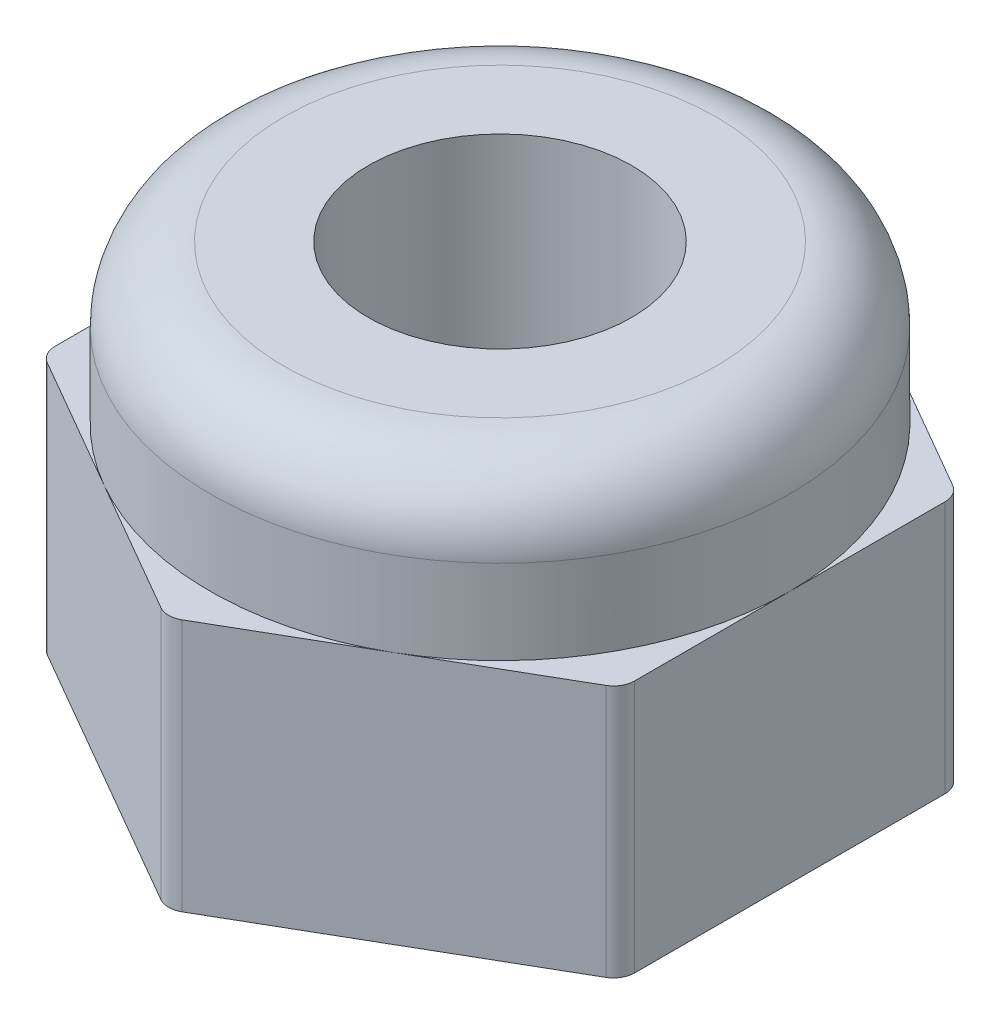
from build123d import *

# Parameters (mm, degrees)
EXTRUDE_1_DEPTH        = 2.4
SKETCH_2_R             = 2.75
EXTRUDE_2_DEPTH        = 3.9
FILLET_1_R             = 0.7
FILLET_2_R             = 0.2
HOLE_WIZARD_M3_1_D     = 2.5
HOLE_WIZARD_M3_1_DEPTH = 7.5
HOLE_WIZARD_M3_1_TIP   = 0.751075774


with BuildPart() as part:
    # 草图1 → 凸台-拉伸1 (new body)
    with BuildSketch(Plane(origin=(0, 0, 0), x_dir=(1, 0, 0), z_dir=(0, 1, 0))):
        Polygon((0, 3.175426481), (-2.75, 1.58771324), (-2.75, -1.58771324), (0, -3.175426481), (2.75, -1.58771324), (2.75, 1.58771324), align=None)
    extrude(amount=EXTRUDE_1_DEPTH)

    # 草图2 → 凸台-拉伸2 (add)
    with BuildSketch(Plane.XZ):
        with Locations(Location((0, 0, 0), (0, 0, 270))):
            Circle(SKETCH_2_R)
    extrude(amount=-EXTRUDE_2_DEPTH)

    # 圆角1
    fillet_1_edges = [part.edges().sort_by_distance(p)[0] for p in [
        (0, 3.9, 2.75),
    ]]
    fillet(fillet_1_edges, radius=FILLET_1_R)

    # 圆角2
    fillet_2_edges = [part.edges().sort_by_distance(p)[0] for p in [
        (2.75, 1.2, -1.58771324),
        (2.75, 1.2, 1.58771324),
        (0, 1.2, 3.175426481),
        (-2.75, 1.2, 1.58771324),
        (-2.75, 1.2, -1.58771324),
        (0, 1.2, -3.175426481),
    ]]
    fillet(fillet_2_edges, radius=FILLET_2_R)

    # M3 螺纹孔1
    with Locations(Plane(origin=(0, 0, 0), x_dir=(-1, 0, 0), z_dir=(0, -1, 0))):
        with Locations((0, 0)):
            Hole(HOLE_WIZARD_M3_1_D / 2, depth=HOLE_WIZARD_M3_1_DEPTH)
            with Locations((0, 0, -(HOLE_WIZARD_M3_1_DEPTH + HOLE_WIZARD_M3_1_TIP / 2))):  # 118° drill point
                Cone(0, HOLE_WIZARD_M3_1_D / 2, HOLE_WIZARD_M3_1_TIP, mode=Mode.SUBTRACT)


solid = part.part
